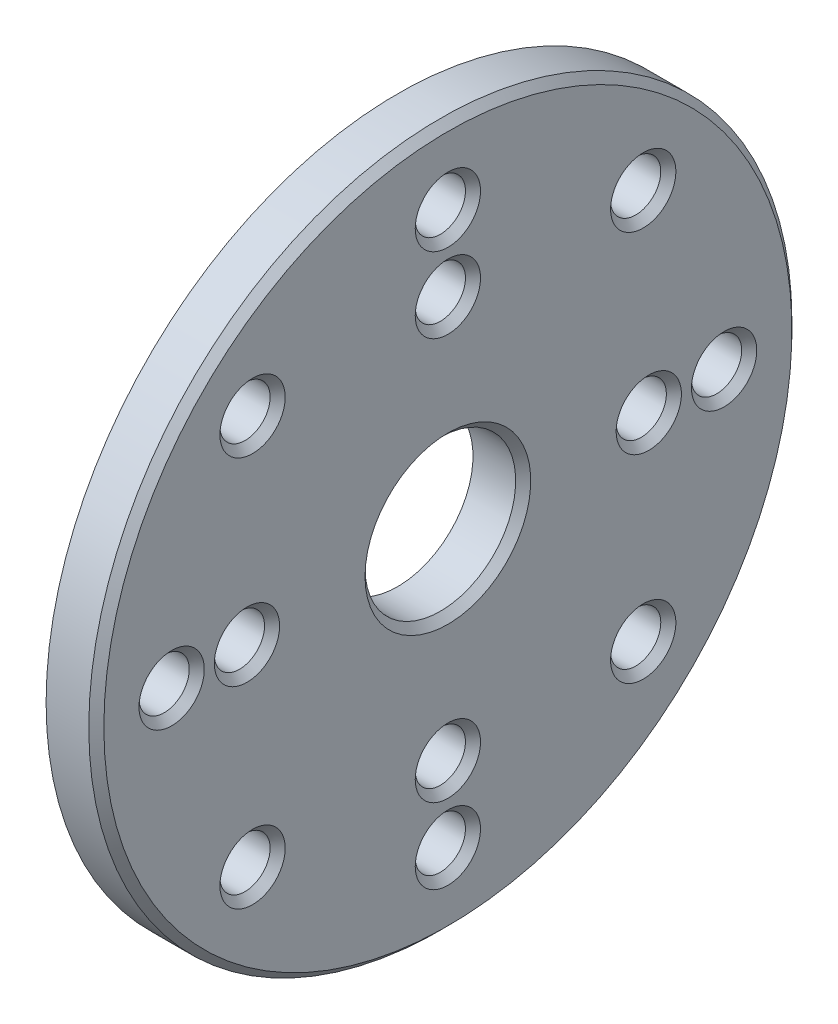
from build123d import *

# Parameters (mm, degrees)
SKETCH1_W          = 2
SKETCH1_H          = 11
SKETCH2_R          = 1
CUT_EXTRUDE1_DEPTH = 20.899748742
CIRPATTERN2_COUNT  = 8
SKETCH3_R          = 1
CUT_EXTRUDE2_DEPTH = 20.899748742
CIRPATTERN3_COUNT  = 4
CHAMFER1_SIZE      = 0.3


with BuildPart() as part:
    # Sketch1 → Revolve1 (revolve)
    with BuildSketch(Plane.XY, mode=Mode.PRIVATE) as revolve1_sk:
        with Locations((-1, 8.5)):
            Rectangle(SKETCH1_W, SKETCH1_H)
    revolve(revolve1_sk.sketch.rotate(Axis((0, 0, 0), (1, 0, 0)), 90), axis=Axis((0, 0, 0), (1, 0, 0)))

    # Sketch2 → Cut-Extrude1 (cut, through all)
    with BuildSketch(Plane(origin=(0, 0, 0), x_dir=(0, 0, -1), z_dir=(1, 0, 0))):
        with Locations((0, 11)):
            Circle(SKETCH2_R)
    cut_extrude1 = extrude(amount=-CUT_EXTRUDE1_DEPTH, mode=Mode.SUBTRACT)

    # CirPattern2: Cut-Extrude1 ×8 about axis
    cirpattern2_axis = Axis((0, 0, 0), (1, 0, 0))
    for i in range(1, CIRPATTERN2_COUNT):
        add(cut_extrude1.rotate(cirpattern2_axis, i * 360 / CIRPATTERN2_COUNT), mode=Mode.SUBTRACT)

    # Sketch3 → Cut-Extrude2 (cut, through all)
    with BuildSketch(Plane(origin=(0, 0, 0), x_dir=(0, 0, -1), z_dir=(1, 0, 0))):
        with Locations((0, 8)):
            Circle(SKETCH3_R)
    cut_extrude2 = extrude(amount=-CUT_EXTRUDE2_DEPTH, mode=Mode.SUBTRACT)

    # CirPattern3: Cut-Extrude2 ×4 about axis
    cirpattern3_axis = Axis((0, 0, 0), (1, 0, 0))
    for i in range(1, CIRPATTERN3_COUNT):
        add(cut_extrude2.rotate(cirpattern3_axis, i * 360 / CIRPATTERN3_COUNT), mode=Mode.SUBTRACT)

    # Chamfer1
    chamfer1_edges = [part.edges().sort_by_distance(p)[0] for p in [
        (0, 11, 1),
        (0, 8.485281374, -7.071067812),
        (0, 1, -11),
        (0, -7.071067812, -8.485281374),
        (0, -11, -1),
        (0, -8.485281374, 7.071067812),
        (0, -1, 11),
        (0, 0, -3),
        (0, 7.071067812, 8.485281374),
        (0, 0, -14),
        (0, 8, 1),
        (0, 1, -8),
        (0, -8, -1),
        (0, -1, 8),
    ]]
    chamfer(chamfer1_edges, length=CHAMFER1_SIZE)


solid = part.part
